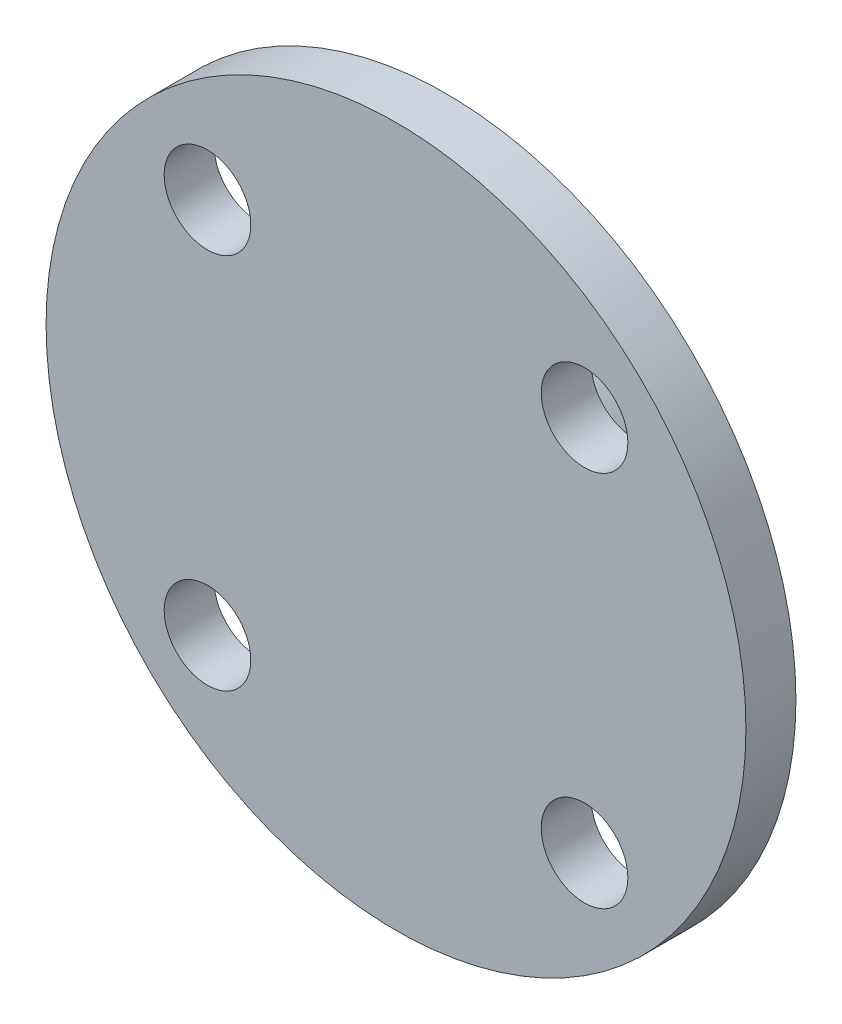
from build123d import *

# Parameters (mm, degrees)
SKETCH_2_R               = 2.6
CUT_EXTRUDE_1_DEPTH      = 3
PATTERN_CIRCULAR_1_COUNT = 4


with BuildPart() as part:
    # Эскиз1 → Повернуть1 (revolve)
    with BuildSketch(Plane(origin=(0, 0, 0), x_dir=(1, 0, 0), z_dir=(0, 1, 0))):
        Polygon((0, 0), (-21, 0), (-21, 3), (-11, 3), (-11, 7), (0, 7), align=None)
    revolve(axis=Axis((0, 0, -7), (0, 0, 1)))

    # Эскиз2 → Вырез-Вытянуть1 (cut)
    with BuildSketch(Plane.XY):
        with Locations((11.313708499, 11.313708499)):
            Circle(SKETCH_2_R)
    cut_extrude_1 = extrude(amount=-CUT_EXTRUDE_1_DEPTH, mode=Mode.SUBTRACT)

    # Круговой массив1: Вырез-Вытянуть1 ×4 about axis
    pattern_circular_1_axis = Axis((0, 0, 0), (0, 0, 1))
    for i in range(1, PATTERN_CIRCULAR_1_COUNT):
        add(cut_extrude_1.rotate(pattern_circular_1_axis, i * 360 / PATTERN_CIRCULAR_1_COUNT), mode=Mode.SUBTRACT)


solid = part.part
